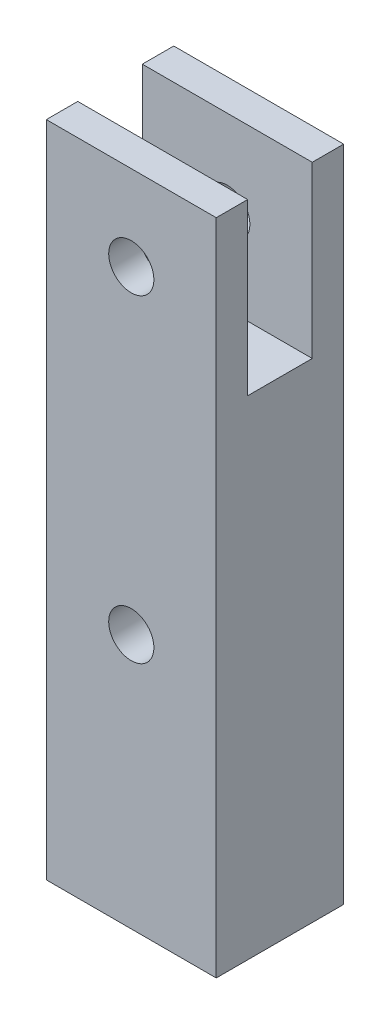
from build123d import *

# Parameters (mm, degrees)
SKETCH1_R           = 3.3782
BOSS_EXTRUDE1_DEPTH = 9.525
SKETCH3_W           = 9.652
SKETCH3_H           = 25.4
CUT_EXTRUDE1_DEPTH  = 68.594698618


with BuildPart() as part:
    # Sketch1 → Boss-Extrude1 (new, symmetric)
    with BuildSketch(Plane.XY):
        Polygon((-12.7, 23.8125), (-12.7, 36.5125), (12.7, 36.5125), (12.7, 23.8125), (12.7, -61.9125), (-12.7, -61.9125), align=None)
        with Locations(Location((0, 23.8125, 0), (0, 0, 180))):
            Circle(SKETCH1_R, mode=Mode.SUBTRACT)
        with Locations(Location((0, -23.8125, 0), (0, 0, 180))):
            Circle(SKETCH1_R, mode=Mode.SUBTRACT)
    extrude(amount=BOSS_EXTRUDE1_DEPTH, both=True)

    # Sketch3 → Cut-Extrude1 (cut, through all)
    with BuildSketch(Plane(origin=(12.7, 0, 0), x_dir=(0, 0, -1), z_dir=(1, 0, 0))):
        with Locations((0, 23.8125)):
            Rectangle(SKETCH3_W, SKETCH3_H)
    extrude(amount=-CUT_EXTRUDE1_DEPTH, mode=Mode.SUBTRACT)


solid = part.part
